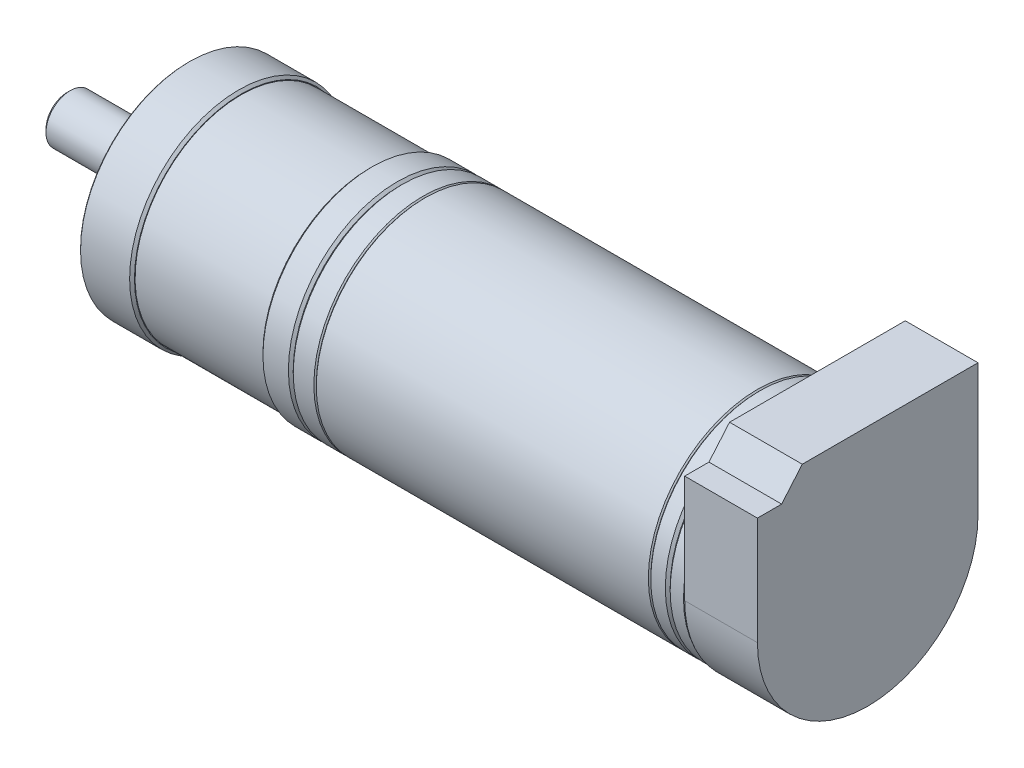
from build123d import *
from build123d.topology import SkipClean

# Parameters (mm, degrees)
SKETCH2_R           = 1.5
CUT_EXTRUDE1_DEPTH  = 8
CHAMFER1_SIZE       = 0.5
BOSS_EXTRUDE1_DEPTH = 12
CUT_EXTRUDE2_START  = -5
CUT_EXTRUDE2_DEPTH  = 5


with BuildPart() as part:
    # Sketch1 → Revolve1 (revolve)
    with BuildSketch(Plane.XY):
        Polygon((-120.1, 0), (-120.1, 3.5), (-119.6, 4), (-102.1, 4), (-102.1, 9.3), (-101.9, 9.5), (-102.1, 9.7), (-102.1, 10.8), (-101.9, 11), (-100.1, 11), (-100.1, 17.8), (-99.9, 18), (-91.8, 18), (-91.4, 17.6), (-91.4, 17.5), (-70.2, 17.5), (-70.2, 17.6), (-69.8, 18), (-65.6, 18), (-65.2, 17.6), (-64.8, 18), (-61.4, 18), (-61.2, 17.8), (-61, 18), (-6.2, 18), (-6, 17.8), (-5.8, 18), (-3.4, 18), (-3, 17.6), (-2.6, 18), (-0.4, 18), (0, 17.6), (0, 0), align=None)
    revolve(axis=Axis((0, 0, 0), (-1, 0, 0)))

    # Sketch2 → Cut-Extrude1 (cut)
    with BuildSketch(Plane.ZY.offset(100.1)):
        with Locations(Location((-15, 0, 0), (0, 0, 270))):
            Circle(SKETCH2_R)
        with Locations(Location((0, 15, 0), (0, 0, 270))):
            Circle(SKETCH2_R)
        with Locations(Location((15, 0, 0), (0, 0, 270))):
            Circle(SKETCH2_R)
        with Locations(Location((0, -15, 0), (0, 0, 270))):
            Circle(SKETCH2_R)
    extrude(amount=-CUT_EXTRUDE1_DEPTH, mode=Mode.SUBTRACT)

    # Chamfer1
    chamfer1_edges = [part.edges().sort_by_distance(p)[0] for p in [
        (-100.1, 1.5, -15),
        (-100.1, 16.5, 0),
        (-100.1, 1.5, 15),
        (-100.1, -13.5, 0),
    ]]
    chamfer(chamfer1_edges, length=CHAMFER1_SIZE)

    # Sketch3 → Boss-Extrude1 (add)
    with BuildSketch(Plane(origin=(0, 0, 0), x_dir=(0, 0, -1), z_dir=(1, 0, 0))):
        with BuildLine():
            Line((18.2, 21.8), (-10.8, 21.8))
            Line((-10.8, 21.8), (-14.2, 17.8))
            Line((-14.2, 17.8), (-18.2, 17.8))
            Line((-18.2, 17.8), (-18.2, 0))
            ThreePointArc((-18.2, 0), (-13.72479508, -11.952823934), (-2.5, -18.027479025))
            Line((-2.5, -18.027479025), (-2.5, -19.027479025))
            ThreePointArc((-2.5, -19.027479025), (0, -20.2), (2.5, -19.027479025))
            Line((2.5, -19.027479025), (2.5, -18.027479025))
            ThreePointArc((2.5, -18.027479025), (13.72479508, -11.952823934), (18.2, 0))
            Line((18.2, 0), (18.2, 21.8))
        make_face()
    extrude(amount=BOSS_EXTRUDE1_DEPTH)

    # Sketch4 → Cut-Extrude2 (cut)
    with SkipClean():  # the faces are left unmerged after this step: merging them gives an invalid solid
        with BuildSketch(Plane(origin=(12, 0, 0), x_dir=(0, 0, -1), z_dir=(1, 0, 0)).offset(CUT_EXTRUDE2_START)):
            with BuildLine():
                Line((2.5, -19.027479025), (2.5, -18.027479025))
                ThreePointArc((2.5, -18.027479025), (0, -18.2), (-2.5, -18.027479025))
                Line((-2.5, -18.027479025), (-2.5, -19.027479025))
                ThreePointArc((-2.5, -19.027479025), (0, -20.2), (2.5, -19.027479025))
            make_face()
        extrude(amount=CUT_EXTRUDE2_DEPTH, mode=Mode.SUBTRACT)


solid = part.part
